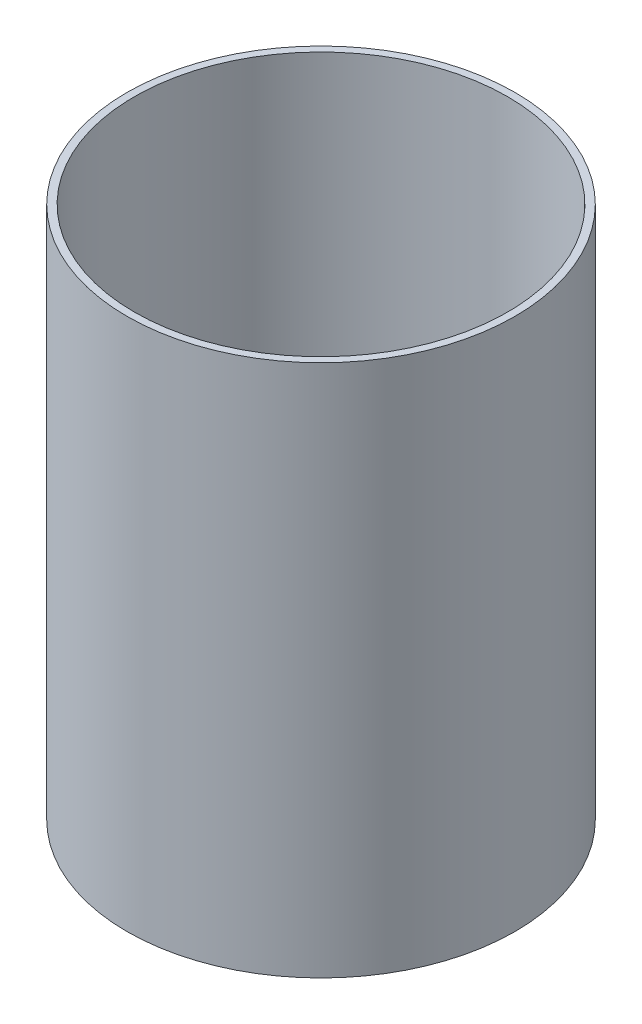
from build123d import *

# Parameters (mm, degrees)
SKETCH1_R           = 132
SKETCH1_R_2         = 127
BOSS_EXTRUDE1_DEPTH = 355.6
BOSS_EXTRUDE2_START = 7
SKETCH2_R           = 132
BOSS_EXTRUDE2_DEPTH = 7
SKETCH3_R           = 2
SKETCH3_W           = 40.05
SKETCH3_H           = 20
CUT_EXTRUDE1_DEPTH  = 408.831779046
SKETCH4_R           = 47.5
CUT_EXTRUDE2_DEPTH  = 402.62091579
SKETCH5_R           = 2
CUT_EXTRUDE3_DEPTH  = 408.831779046


with BuildPart() as part:
    # Sketch1 → Boss-Extrude1 (new body)
    with BuildSketch(Plane(origin=(0, 0, 0), x_dir=(1, 0, 0), z_dir=(0, 1, 0))):
        with Locations(Location((0, 0, 0), (0, 0, 270))):
            Circle(SKETCH1_R)
        with Locations(Location((0, 0, 0), (0, 0, 270))):
            Circle(SKETCH1_R_2, mode=Mode.SUBTRACT)
    extrude(amount=BOSS_EXTRUDE1_DEPTH)

    # Sketch2 → Boss-Extrude2 (add)
    with BuildSketch(Plane.XZ.offset(BOSS_EXTRUDE2_START)):
        with Locations(Location((0, 0, 0), (0, 0, 270))):
            Circle(SKETCH2_R)
    extrude(amount=-BOSS_EXTRUDE2_DEPTH)

    # Sketch3 → Cut-Extrude1 (cut, through all)
    with BuildSketch(Plane.XZ.offset(7)):
        with Locations(Location((-14.05, 5, 0), (0, 0, 270))):
            Circle(SKETCH3_R)
        with Locations(Location((-14.05, -5, 0), (0, 0, 270))):
            Circle(SKETCH3_R)
        with Locations(Location((34.45, 5, 0), (0, 0, 270))):
            Circle(SKETCH3_R)
        with Locations(Location((34.45, -5, 0), (0, 0, 270))):
            Circle(SKETCH3_R)
        with Locations((9.975, 0)):
            Rectangle(SKETCH3_W, SKETCH3_H)
    extrude(amount=-CUT_EXTRUDE1_DEPTH, mode=Mode.SUBTRACT)

    # Sketch4 → Cut-Extrude2 (cut, through all)
    with BuildSketch(Plane(origin=(0, 0, 0), x_dir=(1, 0, 0), z_dir=(0, 1, 0))):
        with Locations(Location((-69.85, 0, 0), (0, 0, 270))):
            Circle(SKETCH4_R)
    extrude(amount=-CUT_EXTRUDE2_DEPTH, mode=Mode.SUBTRACT)

    # Sketch5 → Cut-Extrude3 (cut, through all)
    with BuildSketch(Plane.XZ.offset(7)):
        with Locations(Location((-30.605573644, 39.244426356, 0), (0, 0, 270))):
            Circle(SKETCH5_R)
        with Locations(Location((-30.605573644, -39.244426356, 0), (0, 0, 270))):
            Circle(SKETCH5_R)
        with Locations(Location((-109.094426356, 39.244426356, 0), (0, 0, 270))):
            Circle(SKETCH5_R)
        with Locations(Location((-109.094426356, -39.244426356, 0), (0, 0, 270))):
            Circle(SKETCH5_R)
    extrude(amount=-CUT_EXTRUDE3_DEPTH, mode=Mode.SUBTRACT)


solid = part.part
